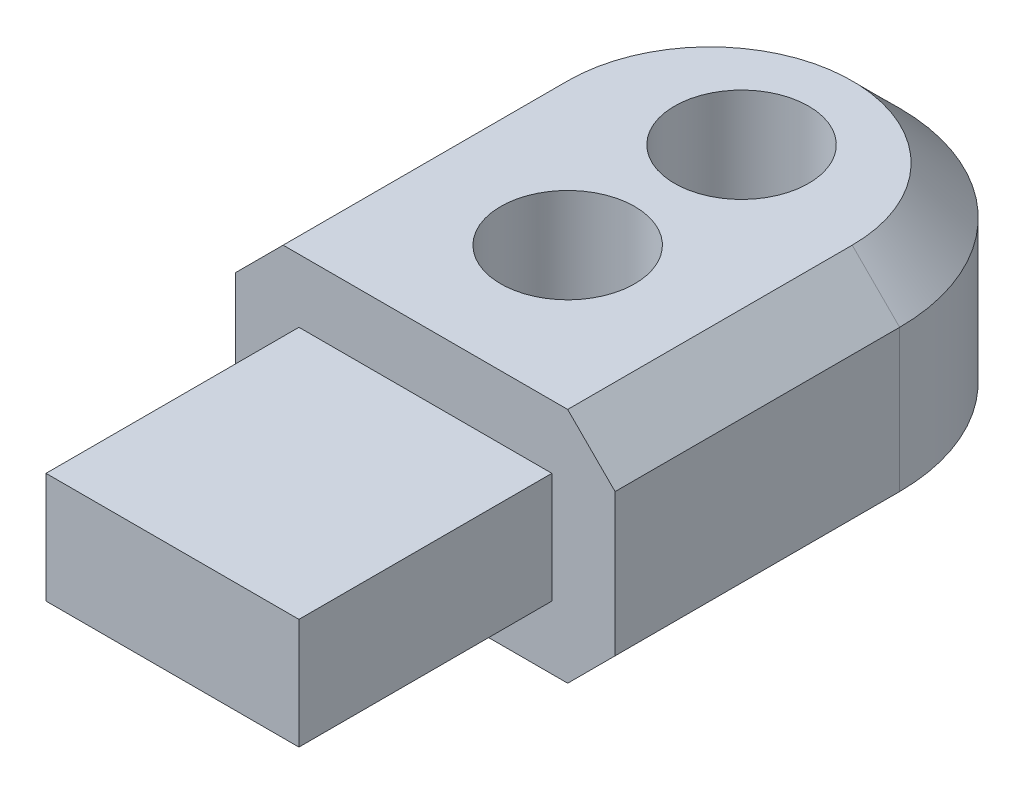
from build123d import *

# Parameters (mm, degrees)
BOSS_EXTRUDE9_DEPTH      = 3.5
BOSS_EXTRUDE9_DEPTH_BACK = 4
SKETCH16_W               = 8
SKETCH16_H               = 3.5
BOSS_EXTRUDE11_DEPTH     = 8
CHAMFER2_SIZE            = 1.5
CUT_EXTRUDE1_DEPTH       = 40.150823276
CUT_EXTRUDE1_DEPTH_BACK  = 40.150823276
SKETCH17_R               = 2.12


with BuildPart() as part:
    # Sketch14 → Boss-Extrude9 (new, two sides: drawn at the far end of the back side and taken through both)
    with BuildSketch(Plane(origin=(0, 0, 0), x_dir=(1, 0, 0), z_dir=(0, 1, 0)).offset(-BOSS_EXTRUDE9_DEPTH_BACK)):
        with BuildLine():
            Line((-4.172171186, -29.619968889), (7.827828814, -29.619968889))
            Line((7.827828814, -29.619968889), (7.827828814, -20.619968889))
            ThreePointArc((7.827828814, -20.619968889), (1.827828814, -14.619968889), (-4.172171186, -20.619968889))
            Line((-4.172171186, -20.619968889), (-4.172171186, -29.619968889))
        make_face()
    extrude(amount=BOSS_EXTRUDE9_DEPTH + BOSS_EXTRUDE9_DEPTH_BACK)

    # Sketch16 → Boss-Extrude11 (add)
    with BuildSketch(Plane.XY.offset(29.619968889)):
        with Locations((1.827828814, -0.25)):
            Rectangle(SKETCH16_W, SKETCH16_H)
    extrude(amount=BOSS_EXTRUDE11_DEPTH)

    # Chamfer2
    chamfer2_edges = [part.edges().sort_by_distance(p)[0] for p in [
        (1.827828814, -4, 14.619968889),
        (7.827828814, 3.5, 25.119968889),
        (1.827828814, 3.5, 14.619968889),
        (-4.172171186, -4, 25.119968889),
        (-4.172171186, 3.5, 25.119968889),
        (7.827828814, -4, 25.119968889),
    ]]
    chamfer(chamfer2_edges, length=CHAMFER2_SIZE)

    # Sketch17 → Cut-Extrude1 (cut, two sides: drawn at the far end of the back side and taken through both)
    with BuildSketch(Plane.XZ.offset(4).offset(-CUT_EXTRUDE1_DEPTH_BACK)):
        with Locations(Location((1.827828814, 25.119968889, 0), (0, 0, 270))):
            Circle(SKETCH17_R)
        with Locations(Location((1.827828814, 19.619968889, 0), (0, 0, 270))):
            Circle(SKETCH17_R)
    extrude(amount=CUT_EXTRUDE1_DEPTH + CUT_EXTRUDE1_DEPTH_BACK, mode=Mode.SUBTRACT)


solid = part.part
